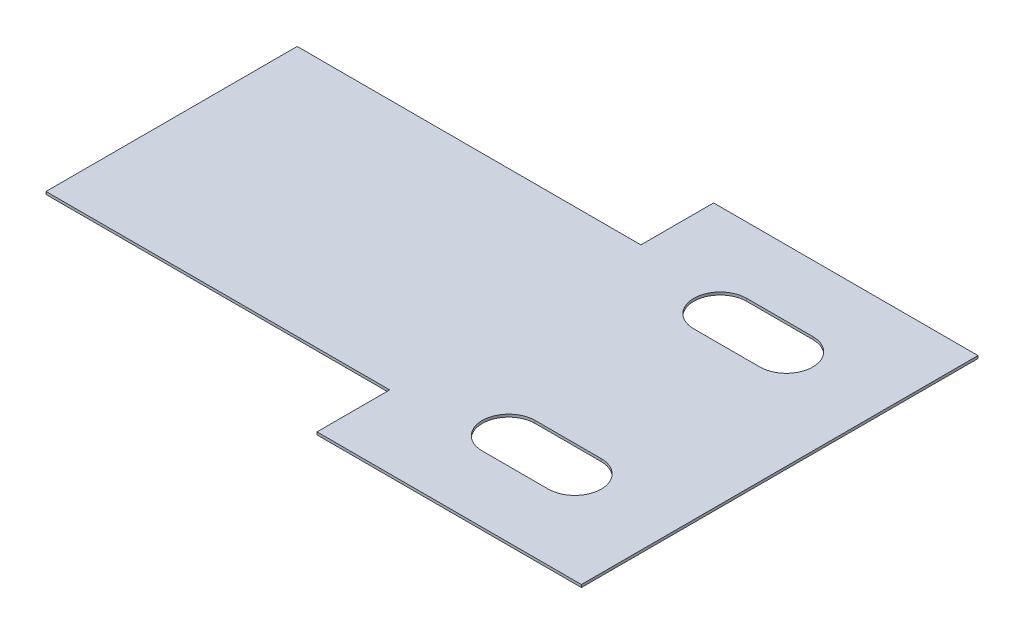
from build123d import *

# Parameters (mm, degrees)
BOSS_EXTRUDE1_DEPTH = 0.05


with BuildPart() as part:
    # Sketch1 → Boss-Extrude1 (new, symmetric)
    with BuildSketch(Plane(origin=(0, 0, 0), x_dir=(1, 0, 0), z_dir=(0, 1, 0))):
        Polygon((-6.778814753, -5.787261175), (6.221185247, -5.787261175), (6.221185247, -8.537261175), (16.221185247, -8.537261175), (16.221185247, 6.462738825), (6.221185247, 6.462738825), (6.221185247, 3.712738825), (-6.778814753, 3.712738825), align=None)
        with BuildLine():
            Line((12.471185247, 3.962738825), (9.971185247, 3.962738825))
            ThreePointArc((9.971185247, 3.962738825), (8.971185247, 2.962738825), (9.971185247, 1.962738825))
            Line((9.971185247, 1.962738825), (12.471185247, 1.962738825))
            ThreePointArc((12.471185247, 1.962738825), (13.471185247, 2.962738825), (12.471185247, 3.962738825))
        make_face(mode=Mode.SUBTRACT)
        with BuildLine():
            Line((12.471185247, -4.037261175), (9.971185247, -4.037261175))
            ThreePointArc((9.971185247, -4.037261175), (8.971185247, -5.037261175), (9.971185247, -6.037261175))
            Line((9.971185247, -6.037261175), (12.471185247, -6.037261175))
            ThreePointArc((12.471185247, -6.037261175), (13.471185247, -5.037261175), (12.471185247, -4.037261175))
        make_face(mode=Mode.SUBTRACT)
    extrude(amount=BOSS_EXTRUDE1_DEPTH, both=True)


solid = part.part
